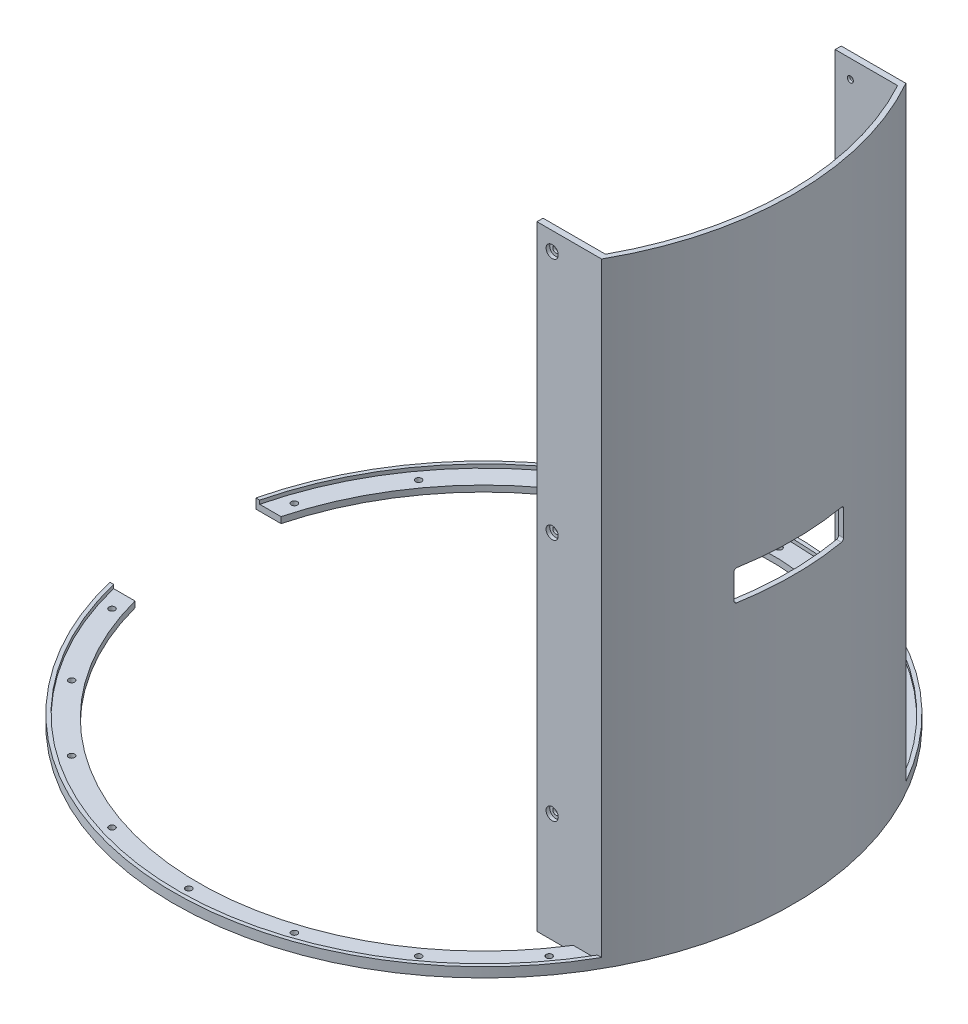
from build123d import *
from build123d.topology import SkipClean

# Parameters (mm, degrees)
SKETCH1_R           = 254.5
SKETCH1_R_2         = 234.5
BOSS_EXTRUDE1_DEPTH = 5
BOSS_EXTRUDE2_DEPTH = 500
SKETCH3_W           = 27.805822748
SKETCH3_H           = 60
CUT_EXTRUDE1_DEPTH  = 500
SKETCH4_R           = 250.5
CUT_EXTRUDE2_DEPTH  = 500
BOSS_EXTRUDE3_DEPTH = 500
BOSS_EXTRUDE4_DEPTH = 5
SKETCH11_W          = 21.416490723
SKETCH11_H          = 190
CUT_EXTRUDE3_DEPTH  = 10
CUT_EXTRUDE4_DEPTH  = 10
FILLET1_R           = 5
SKETCH15_R          = 2.5
CUT_EXTRUDE5_DEPTH  = 10
BOSS_EXTRUDE5_DEPTH = 3
SKETCH18_R          = 2.5
CUT_EXTRUDE6_DEPTH  = 5
CUT_EXTRUDE7_DEPTH  = 7
FILLET2_R           = 5
SKETCH21_R          = 2.5
CUT_EXTRUDE8_DEPTH  = 10
SKETCH22_R          = 2.5
CUT_EXTRUDE9_DEPTH  = 14
SKETCH23_R          = 5
CUT_EXTRUDE10_DEPTH = 3
SKETCH24_W          = 28.197779234
SKETCH24_H          = 25
CUT_EXTRUDE11_DEPTH = 45
FILLET3_R           = 2


with BuildPart() as part:
    # Sketch1 → Boss-Extrude1 (new body)
    with BuildSketch(Plane(origin=(0, 0, 0), x_dir=(1, 0, 0), z_dir=(0, 1, 0))):
        with Locations(Location((0, 0, 0), (0, 0, 270))):
            Circle(SKETCH1_R)
        with Locations(Location((0, 0, 0), (0, 0, 270))):
            Circle(SKETCH1_R_2, mode=Mode.SUBTRACT)
    extrude(amount=BOSS_EXTRUDE1_DEPTH)

    # Sketch2 → Boss-Extrude2 (add)
    with SkipClean():  # the faces are left unmerged after this step: merging them gives an invalid solid
        with BuildSketch(Plane(origin=(0, 5, 0), x_dir=(1, 0, 0), z_dir=(0, 1, 0))):
            with BuildLine():
                Line((254.5, 0), (234.5, 0))
                ThreePointArc((234.5, 0), (225.296071541, 65.053286992), (198.406779118, 125))
                Line((198.406779118, 125), (221.687279743, 125))
                ThreePointArc((221.687279743, 125), (246.16017417, 64.617479467), (254.5, 0))
            make_face()
        boss_extrude2 = extrude(amount=BOSS_EXTRUDE2_DEPTH)

    # Mirror1: Boss-Extrude2 across plane
    with SkipClean():  # the faces are left unmerged after this step: merging them gives an invalid solid
        add(boss_extrude2.mirror(Plane(origin=(0, 505, 0), x_dir=(1, 0, 0), z_dir=(0, 0, 1))))

    # Sketch3 → Cut-Extrude1 (cut)
    with SkipClean():  # the faces are left unmerged after this step: merging them gives an invalid solid
        with BuildSketch(Plane(origin=(0, 5, 0), x_dir=(1, 0, 0), z_dir=(0, 1, 0))):
            with Locations((-240.597088626, 30)):
                Rectangle(SKETCH3_W, SKETCH3_H)
        cut_extrude1 = extrude(amount=-CUT_EXTRUDE1_DEPTH, mode=Mode.SUBTRACT)

    # Mirror2: Cut-Extrude1 across plane
    with SkipClean():  # the faces are left unmerged after this step: merging them gives an invalid solid
        add(cut_extrude1.mirror(Plane.XY), mode=Mode.SUBTRACT)

    # Sketch4 → Cut-Extrude2 (cut)
    with SkipClean():  # the faces are left unmerged after this step: merging them gives an invalid solid
        with BuildSketch(Plane(origin=(0, 505, 0), x_dir=(1, 0, 0), z_dir=(0, 1, 0))):
            Circle(SKETCH4_R)
        extrude(amount=-CUT_EXTRUDE2_DEPTH, mode=Mode.SUBTRACT)

    # Sketch8 → Boss-Extrude3 (add)
    with SkipClean():  # the faces are left unmerged after this step: merging them gives an invalid solid
        with BuildSketch(Plane(origin=(0, 5, 0), x_dir=(1, 0, 0), z_dir=(0, 1, 0))):
            Polygon((217.083509277, 125), (168.583509277, 125), (168.583509277, 120), (220.045796136, 120), (220.045796136, 125), align=None)
        boss_extrude3 = extrude(amount=BOSS_EXTRUDE3_DEPTH)

    # Mirror3: Boss-Extrude3 across plane
    with SkipClean():  # the faces are left unmerged after this step: merging them gives an invalid solid
        add(boss_extrude3.mirror(Plane.XY))

    # Sketch10 → Boss-Extrude4 (add)
    with SkipClean():  # the faces are left unmerged after this step: merging them gives an invalid solid
        with BuildSketch(Plane.XZ):
            with BuildLine():
                Line((198.406779118, 125), (168.583509277, 125))
                Line((168.583509277, 125), (168.583509277, -125))
                Line((168.583509277, -125), (198.406779118, -125))
                ThreePointArc((198.406779118, -125), (234.5, 0), (198.406779118, 125))
            make_face()
        extrude(amount=-BOSS_EXTRUDE4_DEPTH)

    # Sketch11 → Cut-Extrude3 (cut)
    with SkipClean():  # the faces are left unmerged after this step: merging them gives an invalid solid
        with BuildSketch(Plane(origin=(0, 5, 0), x_dir=(1, 0, 0), z_dir=(0, 1, 0))):
            with Locations((179.291754639, -1.5)):
                Rectangle(SKETCH11_W, SKETCH11_H)
        extrude(amount=-CUT_EXTRUDE3_DEPTH, mode=Mode.SUBTRACT)

    # Sketch12 → Cut-Extrude4 (cut)
    with SkipClean():  # the faces are left unmerged after this step: merging them gives an invalid solid
        with BuildSketch(Plane(origin=(0, 5, 0), x_dir=(1, 0, 0), z_dir=(0, 1, 0))):
            with BuildLine():
                Line((213, 93.5), (190, 93.5))
                Line((190, 93.5), (190, 75))
                Line((190, 75), (213, 75))
                ThreePointArc((213, 75), (216.535533906, 76.464466094), (218, 80))
                Line((218, 80), (218, 88.5))
                ThreePointArc((218, 88.5), (216.535533906, 92.035533906), (213, 93.5))
            make_face()
            with BuildLine():
                Line((185, 120), (168.583509277, 120))
                Line((168.583509277, 120), (168.583509277, 93.5))
                Line((168.583509277, 93.5), (190, 93.5))
                Line((190, 93.5), (190, 115))
                ThreePointArc((190, 115), (188.535533906, 118.535533906), (185, 120))
            make_face()
            with BuildLine():
                ThreePointArc((213, -93.5), (216.535533906, -92.035533906), (218, -88.5))
                Line((218, -88.5), (218, -80))
                ThreePointArc((218, -80), (216.535533906, -76.464466094), (213, -75))
                Line((213, -75), (190, -75))
                Line((190, -75), (190, -93.5))
                Line((190, -93.5), (213, -93.5))
            make_face()
            with BuildLine():
                Line((190, -115), (190, -93.5))
                Line((190, -93.5), (168.583509277, -93.5))
                Line((168.583509277, -93.5), (168.583509277, -120))
                Line((168.583509277, -120), (185, -120))
                ThreePointArc((185, -120), (188.535533906, -118.535533906), (190, -115))
            make_face()
        extrude(amount=-CUT_EXTRUDE4_DEPTH, mode=Mode.SUBTRACT)

    # Fillet1
    fillet1_edges = [part.edges().sort_by_distance(p)[0] for p in [
        (190, 2.5, 75),
        (190, 2.5, 93.5),
        (190, 2.5, -93.5),
        (190, 2.5, -75),
    ]]
    fillet(fillet1_edges, radius=FILLET1_R)

    # Sketch15 → Cut-Extrude5 (cut)
    with BuildSketch(Plane(origin=(0, 5, 0), x_dir=(1, 0, 0), z_dir=(0, 1, 0))):
        with Locations(Location((242.5, 0, 0), (0, 0, 270))):
            Circle(SKETCH15_R)
        with Locations(Location((196.186621136, -142.537923681, 0), (0, 0, 270))):
            Circle(SKETCH15_R)
        with Locations(Location((74.936621136, -230.631205202, 0), (0, 0, 270))):
            Circle(SKETCH15_R)
        with Locations(Location((-74.936621136, -230.631205202, 0), (0, 0, 270))):
            Circle(SKETCH15_R)
        with Locations(Location((-196.186621136, -142.537923681, 0), (0, 0, 270))):
            Circle(SKETCH15_R)
        with Locations((-242.5, 0)):
            Circle(SKETCH15_R)
        with Locations(Location((-196.186621136, 142.537923681, 0), (0, 0, 270))):
            Circle(SKETCH15_R)
        with Locations(Location((-74.936621136, 230.631205202, 0), (0, 0, 270))):
            Circle(SKETCH15_R)
        with Locations(Location((74.936621136, 230.631205202, 0), (0, 0, 270))):
            Circle(SKETCH15_R)
        with Locations(Location((196.186621136, 142.537923681, 0), (0, 0, 270))):
            Circle(SKETCH15_R)
    extrude(amount=-CUT_EXTRUDE5_DEPTH, mode=Mode.SUBTRACT)

    # Sketch16 → Boss-Extrude5 (add)
    with SkipClean():  # the faces are left unmerged after this step: merging them gives an invalid solid
        with BuildSketch(Plane(origin=(0, 5, 0), x_dir=(1, 0, 0), z_dir=(0, 1, 0))):
            with BuildLine():
                Line((-247.326201604, 60), (-244.238101041, 60))
                ThreePointArc((-244.238101041, 60), (-35.003834494, 249.052166364), (218.236683443, 125))
                Line((218.236683443, 125), (221.687279743, 125))
                ThreePointArc((221.687279743, 125), (-34.936922855, 252.090581779), (-247.326201604, 60))
            make_face()
            with BuildLine():
                Line((221.687279743, -125), (218.236683443, -125))
                ThreePointArc((218.236683443, -125), (-35.003834494, -249.052166364), (-244.238101041, -60))
                Line((-244.238101041, -60), (-247.326201604, -60))
                ThreePointArc((-247.326201604, -60), (-34.936922855, -252.090581779), (221.687279743, -125))
            make_face()
        extrude(amount=BOSS_EXTRUDE5_DEPTH)

    # Sketch18 → Cut-Extrude6 (cut)
    with BuildSketch(Plane(origin=(0, 5, 0), x_dir=(1, 0, 0), z_dir=(0, 1, 0))):
        with Locations(Location((0, -242.5, 0), (0, 0, 270))):
            Circle(SKETCH18_R)
        with Locations(Location((-142.537923681, -196.186621136, 0), (0, 0, 270))):
            Circle(SKETCH18_R)
        with Locations(Location((-230.631205202, -74.936621136, 0), (0, 0, 270))):
            Circle(SKETCH18_R)
        with Locations(Location((-230.631205202, 74.936621136, 0), (0, 0, 270))):
            Circle(SKETCH18_R)
        with Locations(Location((-142.537923681, 196.186621136, 0), (0, 0, 270))):
            Circle(SKETCH18_R)
        with Locations(Location((0, 242.5, 0), (0, 0, 270))):
            Circle(SKETCH18_R)
        with Locations(Location((142.537923681, 196.186621136, 0), (0, 0, 270))):
            Circle(SKETCH18_R)
        with Locations(Location((230.631205202, 74.936621136, 0), (0, 0, 270))):
            Circle(SKETCH18_R)
        with Locations(Location((230.631205202, -74.936621136, 0), (0, 0, 270))):
            Circle(SKETCH18_R)
        with Locations(Location((142.537923681, -196.186621136, 0), (0, 0, 270))):
            Circle(SKETCH18_R)
    extrude(amount=-CUT_EXTRUDE6_DEPTH, mode=Mode.SUBTRACT)

    # Sketch19 → Cut-Extrude7 (cut)
    with BuildSketch(Plane.XZ):
        with BuildLine():
            Line((193, 20), (207, 20))
            ThreePointArc((207, 20), (209.121320344, 19.121320344), (210, 17))
            Line((210, 17), (210, -17))
            ThreePointArc((210, -17), (209.121320344, -19.121320344), (207, -20))
            Line((207, -20), (193, -20))
            Line((193, -20), (190, -20))
            Line((190, -20), (190, -17))
            Line((190, -17), (190, 17))
            Line((190, 17), (190, 20))
            Line((190, 20), (193, 20))
        make_face()
    extrude(amount=-CUT_EXTRUDE7_DEPTH, mode=Mode.SUBTRACT)

    # Fillet2
    fillet2_edges = [part.edges().sort_by_distance(p)[0] for p in [
        (190, 2.5, -20),
        (190, 2.5, 20),
    ]]
    fillet(fillet2_edges, radius=FILLET2_R)

    # Sketch21 → Cut-Extrude8 (cut)
    with SkipClean():  # the faces are left unmerged after this step: merging them gives an invalid solid
        with BuildSketch(Plane(origin=(0, 5, 0), x_dir=(1, 0, 0), z_dir=(0, 1, 0))):
            with Locations(Location((200, 50, 0), (0, 0, 270))):
                Circle(SKETCH21_R)
            with Locations(Location((200, -50, 0), (0, 0, 270))):
                Circle(SKETCH21_R)
        extrude(amount=-CUT_EXTRUDE8_DEPTH, mode=Mode.SUBTRACT)

    # Sketch22 → Cut-Extrude9 (cut)
    with SkipClean():  # the faces are left unmerged after this step: merging them gives an invalid solid
        with BuildSketch(Plane.XY.offset(125)):
            with Locations((181.083509277, 490)):
                Circle(SKETCH22_R)
            with Locations((181.083509277, 290)):
                Circle(SKETCH22_R)
            with Locations((181.083509277, 90)):
                Circle(SKETCH22_R)
        cut_extrude9 = extrude(amount=-CUT_EXTRUDE9_DEPTH, mode=Mode.SUBTRACT)

    # Mirror4: Cut-Extrude9 across plane
    with SkipClean():  # the faces are left unmerged after this step: merging them gives an invalid solid
        add(cut_extrude9.mirror(Plane.XY), mode=Mode.SUBTRACT)

    # Sketch23 → Cut-Extrude10 (cut)
    with SkipClean():  # the faces are left unmerged after this step: merging them gives an invalid solid
        with BuildSketch(Plane.XY.offset(125)):
            with Locations((181.083509277, 490)):
                Circle(SKETCH23_R)
            with Locations((181.083509277, 290)):
                Circle(SKETCH23_R)
            with Locations((181.083509277, 90)):
                Circle(SKETCH23_R)
        cut_extrude10 = extrude(amount=-CUT_EXTRUDE10_DEPTH, mode=Mode.SUBTRACT)

    # Mirror5: Cut-Extrude10 across plane
    with SkipClean():  # the faces are left unmerged after this step: merging them gives an invalid solid
        add(cut_extrude10.mirror(Plane.XY), mode=Mode.SUBTRACT)

    # Sketch24 → Cut-Extrude11 (cut, symmetric)
    with SkipClean():  # the faces are left unmerged after this step: merging them gives an invalid solid
        with BuildSketch(Plane.XY):
            with Locations((254.5, 246.5)):
                Rectangle(SKETCH24_W, SKETCH24_H)
        extrude(amount=CUT_EXTRUDE11_DEPTH, both=True, mode=Mode.SUBTRACT)

    # Fillet3
    fillet3_edges = [part.edges().sort_by_distance(p)[0] for p in [
        (248.457478811, 259, -45),
        (248.457478811, 234, -45),
        (248.457478811, 259, 45),
        (248.457478811, 234, 45),
    ]]
    fillet(fillet3_edges, radius=FILLET3_R)


solid = part.part
